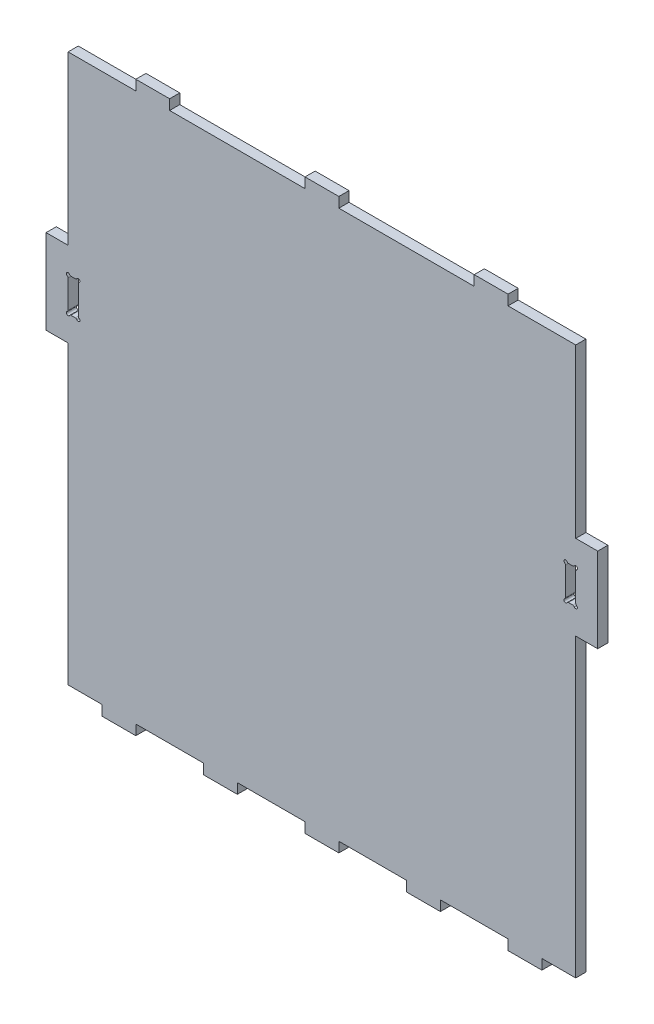
from build123d import *

# Parameters (mm, degrees)
SKETCH1_W           = 3
SKETCH1_H           = 10
BOSS_EXTRUDE2_DEPTH = 3
SKETCH2_R           = 0.5
CUT_EXTRUDE1_DEPTH  = 132.378270654
FILLET1_R           = 0.5


with BuildPart() as part:
    # Sketch1 → Boss-Extrude2 (new body)
    with BuildSketch(Plane.XY):
        Polygon((-5, 65), (5, 65), (5, 62), (45, 62), (45, 65), (55, 65), (55, 62), (75, 62), (75, 12.5), (81.5, 12.5), (81.5, -12.5), (75, -12.5), (75, -100), (65, -100), (65, -103), (55, -103), (55, -100), (35, -100), (35, -103), (25, -103), (25, -100), (5, -100), (5, -103), (-5, -103), (-5, -100), (-25, -100), (-25, -103), (-35, -103), (-35, -100), (-55, -100), (-55, -103), (-65, -103), (-65, -100), (-75, -100), (-75, -12.5), (-81.5, -12.5), (-81.5, 12.5), (-75, 12.5), (-75, 62), (-55, 62), (-55, 65), (-45, 65), (-45, 62), (-5, 62), align=None)
        with Locations((-73.5, 0)):
            Rectangle(SKETCH1_W, SKETCH1_H, mode=Mode.SUBTRACT)
        with Locations((73.5, 0)):
            Rectangle(SKETCH1_W, SKETCH1_H, mode=Mode.SUBTRACT)
    extrude(amount=BOSS_EXTRUDE2_DEPTH)

    # Sketch2 → Cut-Extrude1 (cut, through all)
    with BuildSketch(Plane.XY.offset(3)):
        with Locations((-72, 5)):
            Circle(SKETCH2_R)
        with Locations((-72, -5)):
            Circle(SKETCH2_R)
        with Locations((-75, 5)):
            Circle(SKETCH2_R)
        with Locations((-75, -5)):
            Circle(SKETCH2_R)
        with Locations((75, -5)):
            Circle(SKETCH2_R)
        with Locations((72, -5)):
            Circle(SKETCH2_R)
        with Locations((72, 5)):
            Circle(SKETCH2_R)
        with Locations((75, 5)):
            Circle(SKETCH2_R)
    extrude(amount=-CUT_EXTRUDE1_DEPTH, mode=Mode.SUBTRACT)

    # Fillet1
    fillet1_edges = [part.edges().sort_by_distance(p)[0] for p in [
        (75, 4.5, 1.5),
        (75, -4.5, 1.5),
        (72.5, -5, 1.5),
        (72, 4.5, 1.5),
        (-72.5, -5, 1.5),
        (-74.5, -5, 1.5),
        (-75, 4.5, 1.5),
        (-72.5, 5, 1.5),
        (74.5, -5, 1.5),
        (-75, -4.5, 1.5),
        (-74.5, 5, 1.5),
        (-72, -4.5, 1.5),
        (72, -4.5, 1.5),
        (72.5, 5, 1.5),
        (74.5, 5, 1.5),
        (-72, 4.5, 1.5),
    ]]
    fillet(fillet1_edges, radius=FILLET1_R)


solid = part.part
